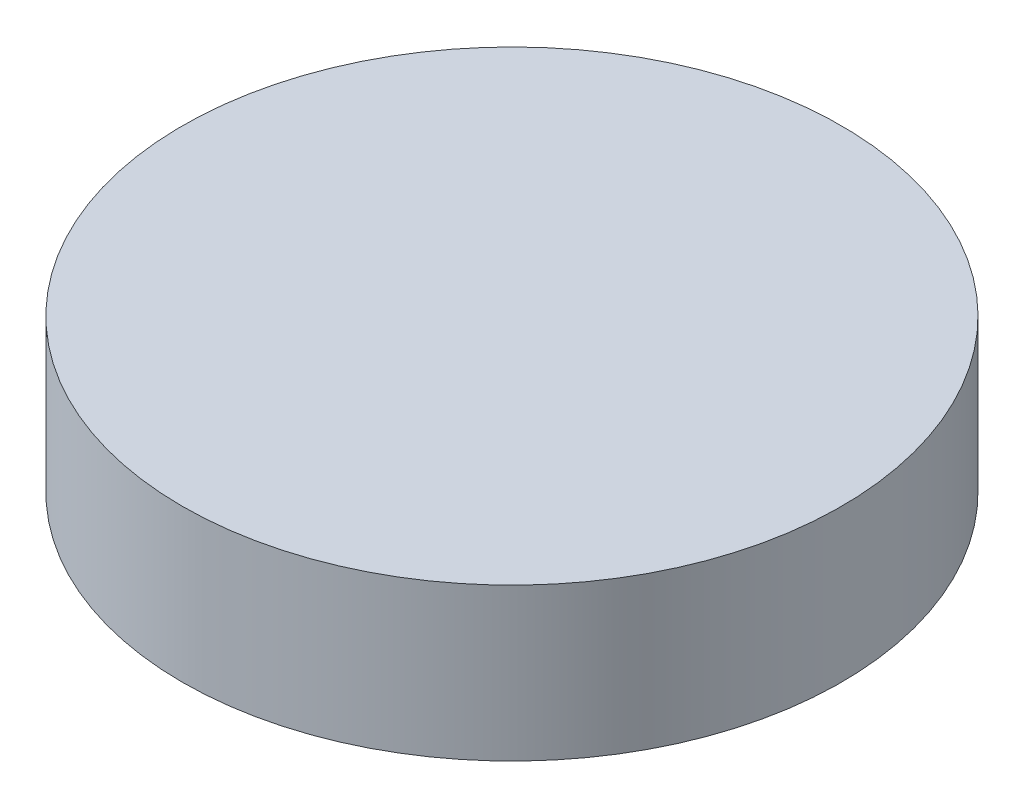
from build123d import *

# Parameters (mm, degrees)
SKETCH1_R           = 35.433
BOSS_EXTRUDE1_DEPTH = 0.508
BOSS_EXTRUDE2_START = -15.875
SKETCH1_3_R         = 35.433
SKETCH1_3_R_2       = 34.925
BOSS_EXTRUDE2_DEPTH = 15.875


with BuildPart() as part:
    # Sketch1 → Boss-Extrude1 (new body)
    with BuildSketch(Plane(origin=(0, 0, 0), x_dir=(1, 0, 0), z_dir=(0, 1, 0))):
        Circle(SKETCH1_R)
    extrude(amount=BOSS_EXTRUDE1_DEPTH)

    # Sketch1<3> → Boss-Extrude2 (add)
    with BuildSketch(Plane(origin=(0, 0, 0), x_dir=(1, 0, 0), z_dir=(0, 1, 0)).offset(BOSS_EXTRUDE2_START)):
        Circle(SKETCH1_3_R)
        Circle(SKETCH1_3_R_2, mode=Mode.SUBTRACT)
    extrude(amount=BOSS_EXTRUDE2_DEPTH)


solid = part.part
